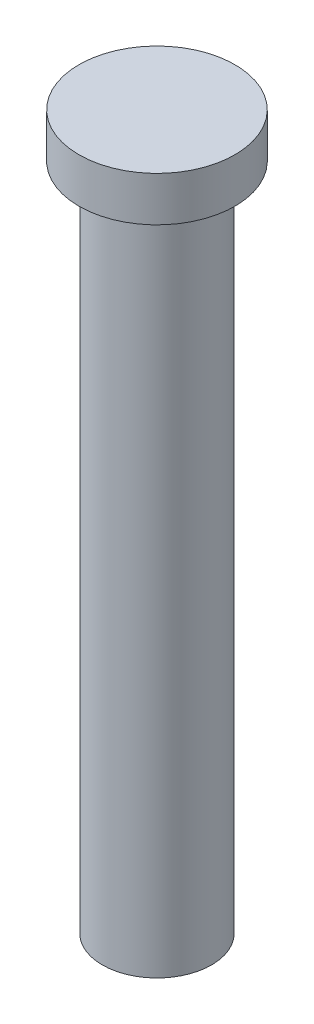
from build123d import *

# Parameters (mm, degrees)
SKETCH1_R           = 2.45
BOSS_EXTRUDE1_DEPTH = 30
SKETCH2_R           = 3.5
BOSS_EXTRUDE2_DEPTH = 2


with BuildPart() as part:
    # Sketch1 → Boss-Extrude1 (new body)
    with BuildSketch(Plane(origin=(0, 0, 0), x_dir=(1, 0, 0), z_dir=(0, 1, 0))):
        with Locations(Location((0, 0, 0), (0, 0, 270))):
            Circle(SKETCH1_R)
    extrude(amount=BOSS_EXTRUDE1_DEPTH)

    # Sketch2 → Boss-Extrude2 (add)
    with BuildSketch(Plane(origin=(0, 30, 0), x_dir=(1, 0, 0), z_dir=(0, 1, 0))):
        with Locations(Location((0, 0, 0), (0, 0, 270))):
            Circle(SKETCH2_R)
    extrude(amount=BOSS_EXTRUDE2_DEPTH)


solid = part.part
